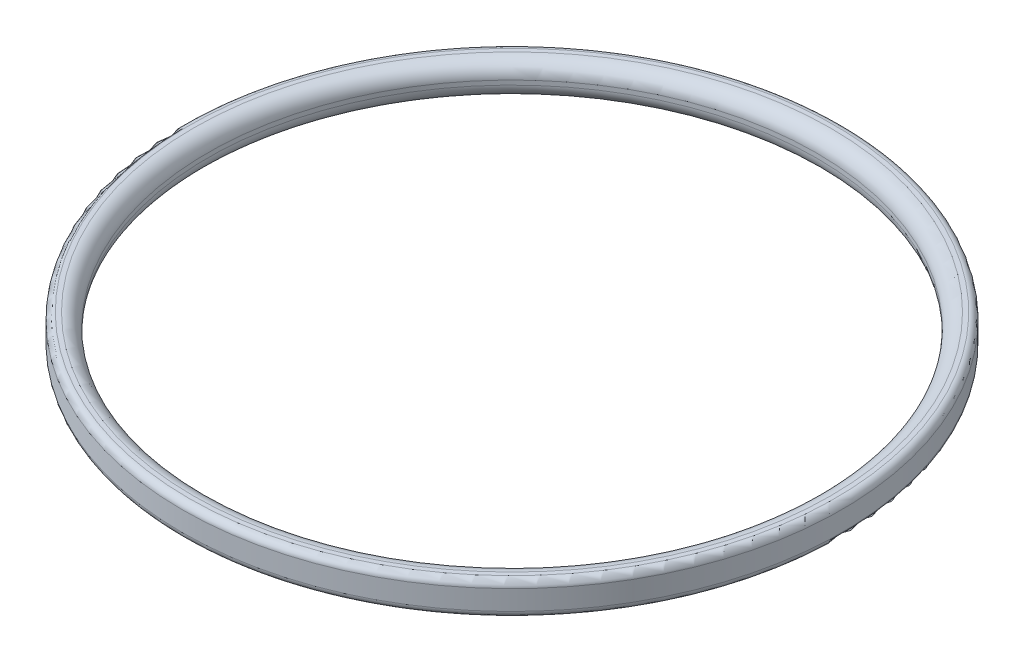
from build123d import *

# Parameters (mm, degrees)
SKETCH2_W = 2.921
SKETCH2_H = 3.81
FILLET1_R = 1.651
FILLET3_R = 0.762


with BuildPart() as part:
    # Sketch2 → Revolve1 (revolve)
    with BuildSketch(Plane.XY, mode=Mode.PRIVATE) as revolve1_sk:
        with Locations((36.6395, 1.905)):
            Rectangle(SKETCH2_W, SKETCH2_H)
    revolve(revolve1_sk.sketch.rotate(Axis((0, -55, 0), (0, 1, 0)), 90), axis=Axis((0, -55, 0), (0, 1, 0)))

    # Fillet1
    fillet1_edges = [part.edges().sort_by_distance(p)[0] for p in [
        (0, 3.81, 35.179),
        (0, 0, 35.179),
    ]]
    fillet(fillet1_edges, radius=FILLET1_R)

    # Fillet3
    fillet3_edges = [part.edges().sort_by_distance(p)[0] for p in [
        (0, 3.81, 38.1),
        (0, 0, 38.1),
    ]]
    fillet(fillet3_edges, radius=FILLET3_R)


solid = part.part
